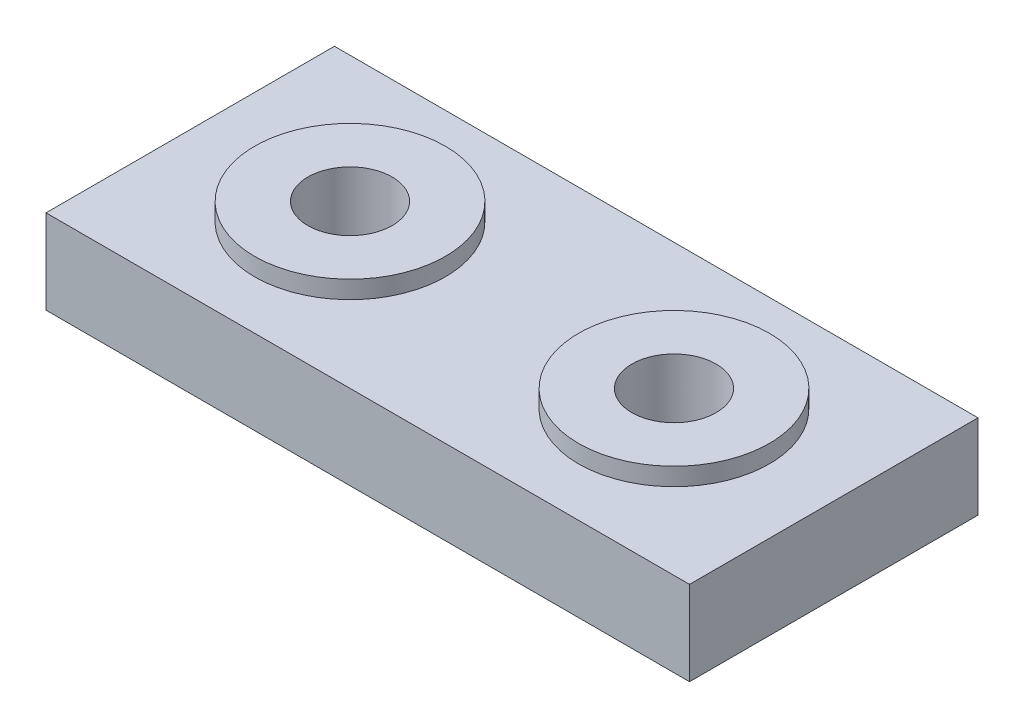
from build123d import *

# Parameters (mm, degrees)
SKETCH1_W           = 14.5
SKETCH1_H           = 6.5
BOSS_EXTRUDE1_DEPTH = 1.9
SHELL1_T            = -1.2
SKETCH2_R           = 2.15
SKETCH2_R_2         = 0.95
BOSS_EXTRUDE2_DEPTH = 0.4
CUT_EXTRUDE1_START  = -3.4
SKETCH3_R           = 0.95
CUT_EXTRUDE1_DEPTH  = 3.4
CUT_EXTRUDE2_START  = -3.4
SKETCH4_R           = 0.95
CUT_EXTRUDE2_DEPTH  = 3.4


with BuildPart() as part:
    # Sketch1 → Boss-Extrude1 (new body)
    with BuildSketch(Plane(origin=(0, 0, 0), x_dir=(1, 0, 0), z_dir=(0, 1, 0))):
        Rectangle(SKETCH1_W, SKETCH1_H)
    extrude(amount=BOSS_EXTRUDE1_DEPTH)

    # Shell1
    shell1_openings = [part.faces().sort_by_distance(p)[0] for p in [
        (0, 0, 0),
    ]]
    offset(amount=SHELL1_T, openings=shell1_openings, kind=Kind.INTERSECTION)

    # Sketch2 → Boss-Extrude2 (add)
    # profile 1 of 2: a face of its own
    with BuildSketch(Plane(origin=(0, 1.9, 0), x_dir=(1, 0, 0), z_dir=(0, 1, 0))):
        with Locations(Location((-3.65, 0, 0), (0, 0, 270))):
            Circle(SKETCH2_R)
        with Locations(Location((-3.65, 0, 0), (0, 0, 270))):
            Circle(SKETCH2_R_2, mode=Mode.SUBTRACT)
    # profile 2 of 2: a face of its own
    with BuildSketch(Plane(origin=(0, 1.9, 0), x_dir=(1, 0, 0), z_dir=(0, 1, 0))):
        with Locations(Location((3.65, 0, 0), (0, 0, 90))):
            Circle(SKETCH2_R)
        with Locations(Location((3.65, 0, 0), (0, 0, 90))):
            Circle(SKETCH2_R_2, mode=Mode.SUBTRACT)
    extrude(amount=BOSS_EXTRUDE2_DEPTH)

    # Sketch3 → Cut-Extrude1 (cut)
    with BuildSketch(Plane(origin=(0, 1.9, 0), x_dir=(1, 0, 0), z_dir=(0, 1, 0)).offset(CUT_EXTRUDE1_START)):
        with Locations(Location((-3.65, 0, 0), (0, 0, 270))):
            Circle(SKETCH3_R)
    extrude(amount=CUT_EXTRUDE1_DEPTH, mode=Mode.SUBTRACT)

    # Sketch4 → Cut-Extrude2 (cut)
    with BuildSketch(Plane(origin=(0, 1.9, 0), x_dir=(1, 0, 0), z_dir=(0, 1, 0)).offset(CUT_EXTRUDE2_START)):
        with Locations(Location((3.65, 0, 0), (0, 0, 90))):
            Circle(SKETCH4_R)
    extrude(amount=CUT_EXTRUDE2_DEPTH, mode=Mode.SUBTRACT)


solid = part.part
